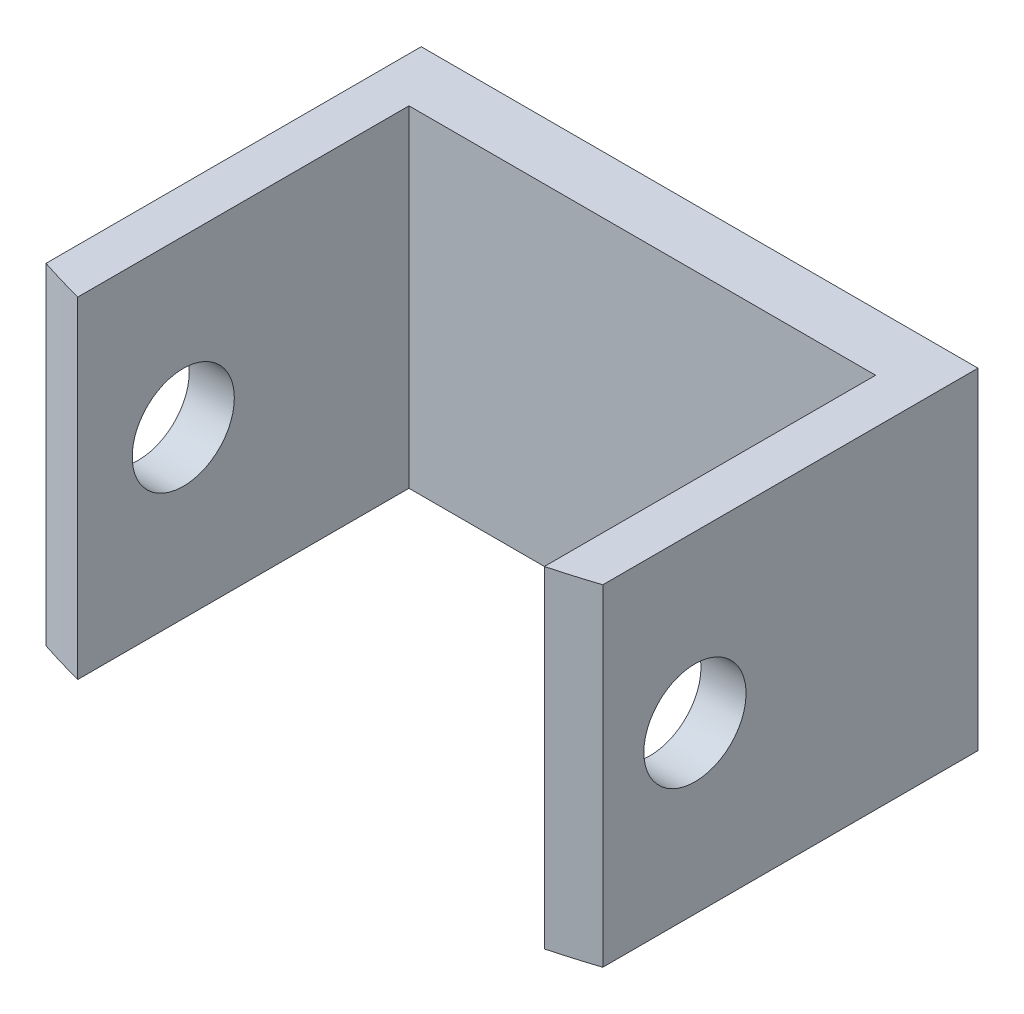
from build123d import *

# Parameters (mm, degrees)
BOSS_EXTRUDE1_DEPTH = 28
CUT_EXTRUDE1_DEPTH  = 90.677477663
SKETCH5_R           = 6.35
CUT_EXTRUDE2_DEPTH  = 4.572
SKETCH8_R           = 6.35
SKETCH8_R_2         = 4.318
BOSS_EXTRUDE4_DEPTH = 6.858
CUT_EXTRUDE6_START  = -2.54
CUT_EXTRUDE6_DEPTH  = 91.021953984
SKETCH14_W          = 51.838761269
SKETCH14_H          = 46.114624518
CUT_EXTRUDE7_DEPTH  = 83.190253836


with BuildPart() as part:
    # Sketch2 → Boss-Extrude1 (new body)
    with BuildSketch(Plane(origin=(0, 0, 0), x_dir=(1, 0, 0), z_dir=(0, 1, 0))):
        with BuildLine():
            Line((-38.1, -65.991135768), (0, 0))
            Line((0, 0), (0, -76.2))
            ThreePointArc((0, -76.2), (-19.722011237, -73.603547963), (-38.1, -65.991135768))
        make_face()
    boss_extrude1 = extrude(amount=BOSS_EXTRUDE1_DEPTH)

    # Sketch4 → Cut-Extrude1 (cut, symmetric)
    with BuildSketch(Plane(origin=(0, 28, 0), x_dir=(1, 0, 0), z_dir=(0, 1, 0))):
        Polygon((-19.722011237, -73.603547963), (-19.722011237, -45.603553163), (19.722011237, -45.603553163), (19.722011237, -73.603547963), (19.722011237, -89.083413221), (-19.722011237, -89.083413221), align=None)
    cut_extrude1 = extrude(amount=CUT_EXTRUDE1_DEPTH, both=True, mode=Mode.SUBTRACT)

    # Sketch5 → Cut-Extrude2 (cut)
    with BuildSketch(Plane(origin=(-19.722011237, 0, 0), x_dir=(0, 0, -1), z_dir=(1, 0, 0))):
        with Locations((-64.683550563, 14)):
            Circle(SKETCH5_R)
    cut_extrude2 = extrude(amount=-CUT_EXTRUDE2_DEPTH, mode=Mode.SUBTRACT)

    # Sketch8 → Boss-Extrude4 (add)
    with BuildSketch(Plane(origin=(-19.722011237, 0, 0), x_dir=(0, 0, -1), z_dir=(1, 0, 0))):
        with Locations((-64.683550563, 14)):
            Circle(SKETCH8_R)
        with Locations((-64.683550563, 14)):
            Circle(SKETCH8_R_2, mode=Mode.SUBTRACT)
    boss_extrude4 = extrude(amount=-BOSS_EXTRUDE4_DEPTH)

    # Sketch13 → Cut-Extrude6 (cut)
    with BuildSketch(Plane(origin=(0, 0, 0), x_dir=(1, 0, 0), z_dir=(0, 1, 0)).offset(CUT_EXTRUDE6_START)):
        Polygon((-23.532011237, -79.497992122), (-59.753612954, -79.497992122), (-59.753612954, -51.700018712), (-33.00752403, -46.22932884), (-23.532011237, -36.276651464), (-23.532011237, -51.700018712), align=None)
        with BuildLine():
            Line((-6.646719096, -17.852832416), (-17.283715983, -36.276651464))
            Line((-17.283715983, -36.276651464), (-10.73360519, -40.058359694))
            Line((-10.73360519, -40.058359694), (-3.170188732, -40.058359694))
            Line((-3.170188732, -40.058359694), (-3.170188732, -18.78436593))
            ThreePointArc((-3.170188732, -18.78436593), (-4.930502865, -18.400886976), (-6.646719096, -17.852832416))
        make_face()
    cut_extrude6 = extrude(amount=CUT_EXTRUDE6_DEPTH, mode=Mode.SUBTRACT)

    # Sketch14 → Cut-Extrude7 (cut, symmetric)
    with BuildSketch(Plane(origin=(0, 28, 0), x_dir=(1, 0, 0), z_dir=(0, 1, 0))):
        with Locations((2.387369397, -17.701326807)):
            Rectangle(SKETCH14_W, SKETCH14_H)
    cut_extrude7 = extrude(amount=CUT_EXTRUDE7_DEPTH, both=True, mode=Mode.SUBTRACT)

    # Mirror2: Boss-Extrude1, Cut-Extrude1, Cut-Extrude2, Boss-Extrude4, Cut-Extrude6, Cut-Extrude7 across plane
    add(boss_extrude1.mirror(Plane(origin=(0, 28, 0), x_dir=(0, 0, 1), z_dir=(-1, 0, 0))))
    add(cut_extrude1.mirror(Plane(origin=(0, 28, 0), x_dir=(0, 0, 1), z_dir=(-1, 0, 0))), mode=Mode.SUBTRACT)
    add(cut_extrude2.mirror(Plane(origin=(0, 28, 0), x_dir=(0, 0, 1), z_dir=(-1, 0, 0))), mode=Mode.SUBTRACT)
    add(boss_extrude4.mirror(Plane(origin=(0, 28, 0), x_dir=(0, 0, 1), z_dir=(-1, 0, 0))))
    add(cut_extrude6.mirror(Plane(origin=(0, 28, 0), x_dir=(0, 0, 1), z_dir=(-1, 0, 0))), mode=Mode.SUBTRACT)
    add(cut_extrude7.mirror(Plane(origin=(0, 28, 0), x_dir=(0, 0, 1), z_dir=(-1, 0, 0))), mode=Mode.SUBTRACT)


solid = part.part
